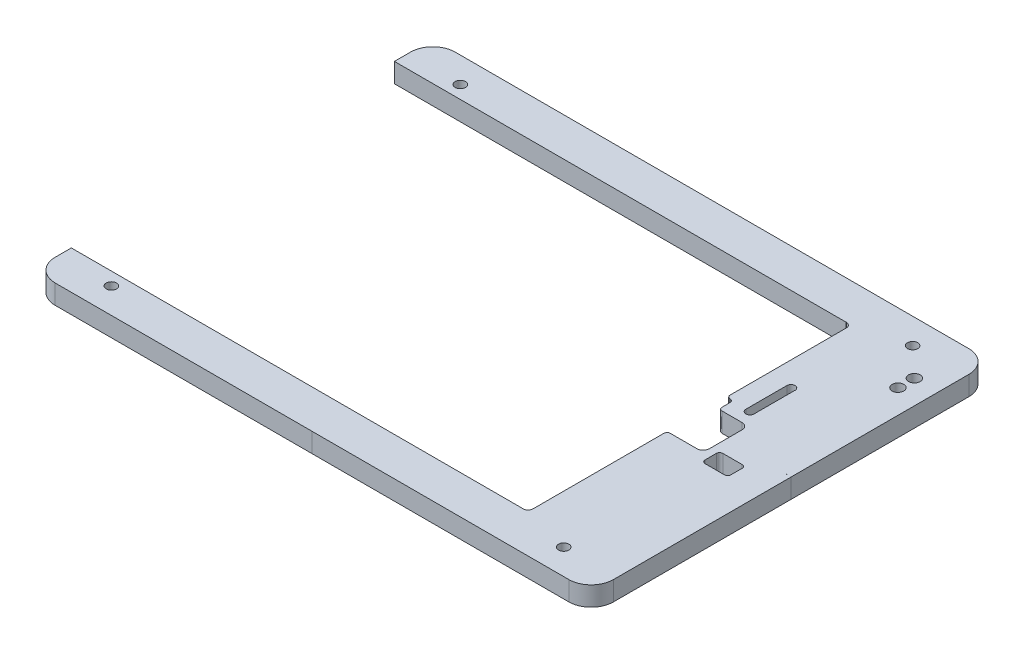
from build123d import *

# Parameters (mm, degrees)
SKIZZE1_R                       = 0.0635
SKIZZE1_R_2                     = 1.59999934
SKIZZE1_R_3                     = 1.79999894
AUFSATZ_LINEAR_AUSTRAGEN1_DEPTH = 6


with BuildPart() as part:
    # Skizze1 → Aufsatz-Linear austragen1 (new body)
    with BuildSketch(Plane(origin=(0, 0, 0), x_dir=(1, 0, 0), z_dir=(0, 1, 0))):
        with BuildLine():
            Line((-86.39999891, 50.00000287), (53.43650095, 50.00000287))
            ThreePointArc((53.43650095, 50.00000287), (53.50067303, 50.063499313), (53.563486724, 49.998658786))
            ThreePointArc((53.563486724, 49.998658786), (54.560660834, 49.560663139), (54.998656411, 48.563488998))
            ThreePointArc((54.998656411, 48.563488998), (55.063496933, 48.500675299), (55.000000486, 48.436503224))
            Line((55.000000486, 48.436503224), (54.99999795, 12.500004281))
            ThreePointArc((54.99999795, 12.500004281), (55.292891674, 11.792896174), (55.99999976, 11.5000024))
            ThreePointArc((55.99999976, 11.5000024), (56.707106025, 11.207109395), (56.99999903, 10.50000313))
            Line((56.99999903, 10.50000313), (56.99999903, 8.00000305))
            ThreePointArc((56.99999903, 8.00000305), (57.292892407, 7.292895887), (57.99999957, 7.00000251))
            Line((57.99999957, 7.00000251), (64.24999977, 7.00000251))
            ThreePointArc((64.24999977, 7.00000251), (65.607645667, 6.437647167), (66.17000101, 5.08000127))
            Line((66.17000101, 5.08000127), (66.17000101, -5.07999873))
            ThreePointArc((66.17000101, -5.07999873), (65.607645667, -6.437644627), (64.24999977, -6.99999997))
            Line((64.24999977, -6.99999997), (55.99999849, -6.99999997))
            ThreePointArc((55.99999849, -6.99999997), (55.292892225, -7.292892975), (54.99999922, -7.99999924))
            Line((54.99999922, -7.99999924), (54.99999922, -48.49999952))
            ThreePointArc((54.99999922, -48.49999952), (54.560659527, -49.560659367), (53.49999968, -49.99999906))
            Line((53.49999968, -49.99999906), (-86.40000018, -49.99999906))
            Line((-86.40000018, -49.99999906), (-86.40000018, -54.99999922))
            ThreePointArc((-86.40000018, -54.99999922), (-84.379038194, -59.879033386), (-79.500004221, -61.89999584))
            Line((-79.500004221, -61.89999584), (-5.627e-06, -61.90000346))
            Line((-5.627e-06, -61.90000346), (79.499999141, -61.89999584))
            ThreePointArc((79.499999141, -61.89999584), (84.379034125, -59.879032902), (86.39999637, -54.999997631))
            Line((86.39999637, -54.999997631), (86.39999383, -1.1416e-05))
            Line((86.39999383, -1.1416e-05), (86.39999637, 55.00000049))
            ThreePointArc((86.39999637, 55.00000049), (84.379034012, 59.879035554), (79.499999141, 61.89999838))
            Line((79.499999141, 61.89999838), (0.000118912, 61.900006))
            Line((0.000118912, 61.900006), (-79.50000356, 61.89999838))
            ThreePointArc((-79.50000356, 61.89999838), (-84.379040097, 59.879034549), (-86.40000145, 54.999996985))
            Line((-86.40000145, 54.999996985), (-86.39999891, 50.00000287))
        make_face()
        with Locations(Location((84.99999383, -1.1351e-05, 0), (0, 0, 270))):
            Circle(SKIZZE1_R, mode=Mode.SUBTRACT)
        with BuildLine():
            Line((68.50000016, -8.75000282), (68.50000016, -5.24999966))
            ThreePointArc((68.50000016, -5.24999966), (68.792893537, -4.542892497), (69.5000007, -4.24999912))
            Line((69.5000007, -4.24999912), (75.49999886, -4.24999912))
            ThreePointArc((75.49999886, -4.24999912), (76.207106023, -4.542892497), (76.4999994, -5.24999966))
            Line((76.4999994, -5.24999966), (76.4999994, -8.75000282))
            ThreePointArc((76.4999994, -8.75000282), (76.207106023, -9.457109983), (75.49999886, -9.75000336))
            Line((75.49999886, -9.75000336), (69.5000007, -9.75000336))
            ThreePointArc((69.5000007, -9.75000336), (68.792893537, -9.457109983), (68.50000016, -8.75000282))
        make_face(mode=Mode.SUBTRACT)
        with Locations(Location((-69.9999997, 54.00000122, 0), (0, 0, 270))):
            Circle(SKIZZE1_R_2, mode=Mode.SUBTRACT)
        with BuildLine():
            Line((63.76999946, 23.78650056), (63.76999946, 11.15000056))
            ThreePointArc((63.76999946, 11.15000056), (62.49999946, 9.88000056), (61.22999946, 11.15000056))
            Line((61.22999946, 11.15000056), (61.22999946, 23.85000056))
            ThreePointArc((61.22999946, 23.85000056), (62.46824946, 25.119603623), (63.76841196, 23.913480713))
            ThreePointArc((63.76841196, 23.913480713), (63.833494498, 23.850794372), (63.76999946, 23.78650056))
        make_face(mode=Mode.SUBTRACT)
        with Locations(Location((78.99999948, 40.46000036, 0), (0, 0, 270))):
            Circle(SKIZZE1_R_3, mode=Mode.SUBTRACT)
        with Locations(Location((78.99999948, 45.54000036, 0), (0, 0, 270))):
            Circle(SKIZZE1_R_3, mode=Mode.SUBTRACT)
        with Locations(Location((69.9999997, 54.00000122, 0), (0, 0, 270))):
            Circle(SKIZZE1_R_2, mode=Mode.SUBTRACT)
        with Locations(Location((-69.9999997, -54.00000122, 0), (0, 0, 270))):
            Circle(SKIZZE1_R_2, mode=Mode.SUBTRACT)
        with Locations(Location((69.9999997, -54.00000122, 0), (0, 0, 270))):
            Circle(SKIZZE1_R_2, mode=Mode.SUBTRACT)
    extrude(amount=AUFSATZ_LINEAR_AUSTRAGEN1_DEPTH)


solid = part.part
